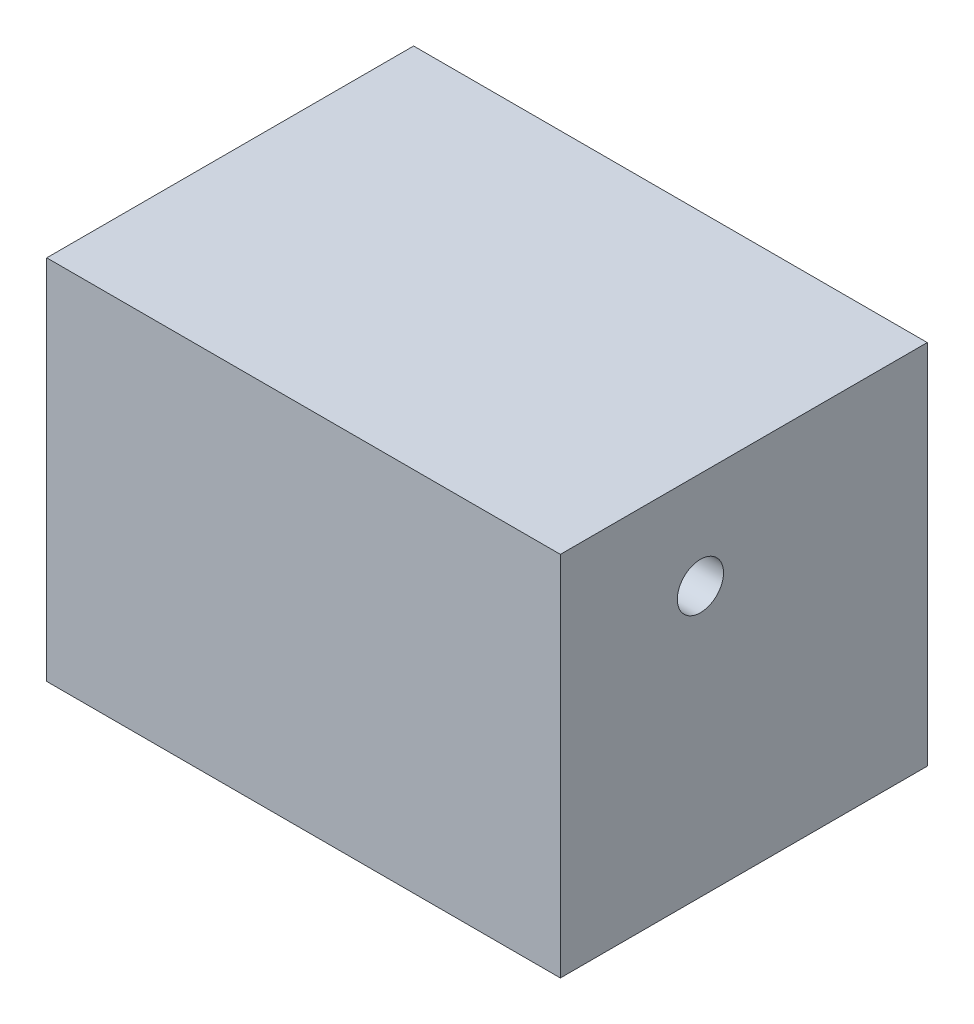
from build123d import *

# Parameters (mm, degrees)
SKETCH1_W           = 70
SKETCH1_H           = 50
BOSS_EXTRUDE1_DEPTH = 50
CUT_EXTRUDE1_START  = -5
SKETCH2_W           = 60
SKETCH2_H           = 40
CUT_EXTRUDE1_DEPTH  = 40
CUT_EXTRUDE2_REACH  = 81.52
SKETCH3_R           = 3
CUT_EXTRUDE3_REACH  = 92.673
SKETCH4_R           = 3.149743794
CUT_EXTRUDE4_REACH  = 92.673
SKETCH5_R           = 4.144549467


with BuildPart() as part:
    # Sketch1 → Boss-Extrude1 (new body)
    with BuildSketch(Plane.XY):
        with Locations((-7.408376963, -3.664921466)):
            Rectangle(SKETCH1_W, SKETCH1_H)
    extrude(amount=BOSS_EXTRUDE1_DEPTH)

    # Sketch2 → Cut-Extrude1 (cut)
    with BuildSketch(Plane(origin=(0, 0, 0), x_dir=(-1, 0, 0), z_dir=(0, 0, -1)).offset(CUT_EXTRUDE1_START)):
        with Locations((7.408376963, -3.664921466)):
            Rectangle(SKETCH2_W, SKETCH2_H)
    extrude(amount=-CUT_EXTRUDE1_DEPTH, mode=Mode.SUBTRACT)

    # Sketch3 → Cut-Extrude2 (cut, up to next)
    with BuildSketch(Plane(origin=(0, -23.664921466, 0), x_dir=(1, 0, 0), z_dir=(0, 1, 0)), mode=Mode.PRIVATE) as cut_extrude2_sk1:
        with Locations(Location((11.436283644, -25.254491461, 0), (0, 0, 270))):
            Circle(SKETCH3_R)
    cut_extrude2_tool1 = extrude(cut_extrude2_sk1.sketch, amount=-CUT_EXTRUDE2_REACH, mode=Mode.PRIVATE) & part.part
    add(cut_extrude2_tool1.solids().sort_by_distance((11.436284, -23.664921, 25.254491))[0], mode=Mode.SUBTRACT)

    # Sketch4 → Cut-Extrude3 (cut, up to next)
    with BuildSketch(Plane(origin=(27.591623037, 0, 0), x_dir=(0, 0, -1), z_dir=(1, 0, 0)), mode=Mode.PRIVATE) as cut_extrude3_sk1:
        with Locations((-30.913262832, 8.056606799)):
            Circle(SKETCH4_R)
    cut_extrude3_tool1 = extrude(cut_extrude3_sk1.sketch, amount=-CUT_EXTRUDE3_REACH, mode=Mode.PRIVATE) & part.part
    add(cut_extrude3_tool1.solids().sort_by_distance((27.591623, 8.056607, 30.913263))[0], mode=Mode.SUBTRACT)

    # Sketch5 → Cut-Extrude4 (cut, up to next)
    with BuildSketch(Plane.ZY.offset(42.408376963), mode=Mode.PRIVATE) as cut_extrude4_sk1:
        with Locations((23.999844242, 3.360492079)):
            Circle(SKETCH5_R)
    cut_extrude4_tool1 = extrude(cut_extrude4_sk1.sketch, amount=-CUT_EXTRUDE4_REACH, mode=Mode.PRIVATE) & part.part
    add(cut_extrude4_tool1.solids().sort_by_distance((-42.408377, 3.360492, 23.999844))[0], mode=Mode.SUBTRACT)


solid = part.part
